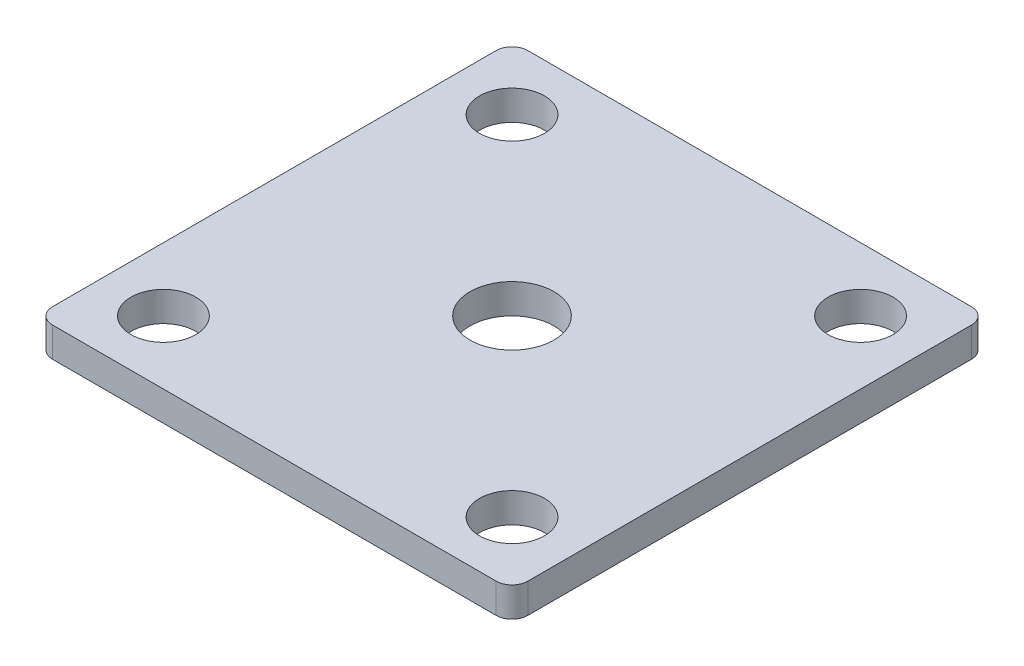
from build123d import *

# Parameters (mm, degrees)
SKETCH2_W           = 38.1
SKETCH2_H           = 38.1
SKETCH2_R           = 2.6035
SKETCH2_R_2         = 3.3655
BOSS_EXTRUDE1_DEPTH = 2.38125
FILLET1_R           = 1.27


with BuildPart() as part:
    # Sketch2 → Boss-Extrude1 (new body)
    with BuildSketch(Plane(origin=(0, 0, 0), x_dir=(1, 0, 0), z_dir=(0, 1, 0))):
        Rectangle(SKETCH2_W, SKETCH2_H)
        with Locations(Location((-13.97, 13.97, 0), (0, 0, 90))):
            Circle(SKETCH2_R, mode=Mode.SUBTRACT)
        with Locations(Location((-13.97, -13.97, 0), (0, 0, 90))):
            Circle(SKETCH2_R, mode=Mode.SUBTRACT)
        with Locations(Location((13.97, -13.97, 0), (0, 0, 90))):
            Circle(SKETCH2_R, mode=Mode.SUBTRACT)
        with Locations(Location((13.97, 13.97, 0), (0, 0, 90))):
            Circle(SKETCH2_R, mode=Mode.SUBTRACT)
        with Locations(Location((0, 0, 0), (0, 0, 90))):
            Circle(SKETCH2_R_2, mode=Mode.SUBTRACT)
    extrude(amount=BOSS_EXTRUDE1_DEPTH)

    # Fillet1
    fillet1_edges = [part.edges().sort_by_distance(p)[0] for p in [
        (19.05, 1.190625, 19.05),
        (-19.05, 1.190625, 19.05),
        (-19.05, 1.190625, -19.05),
        (19.05, 1.190625, -19.05),
    ]]
    fillet(fillet1_edges, radius=FILLET1_R)


solid = part.part
